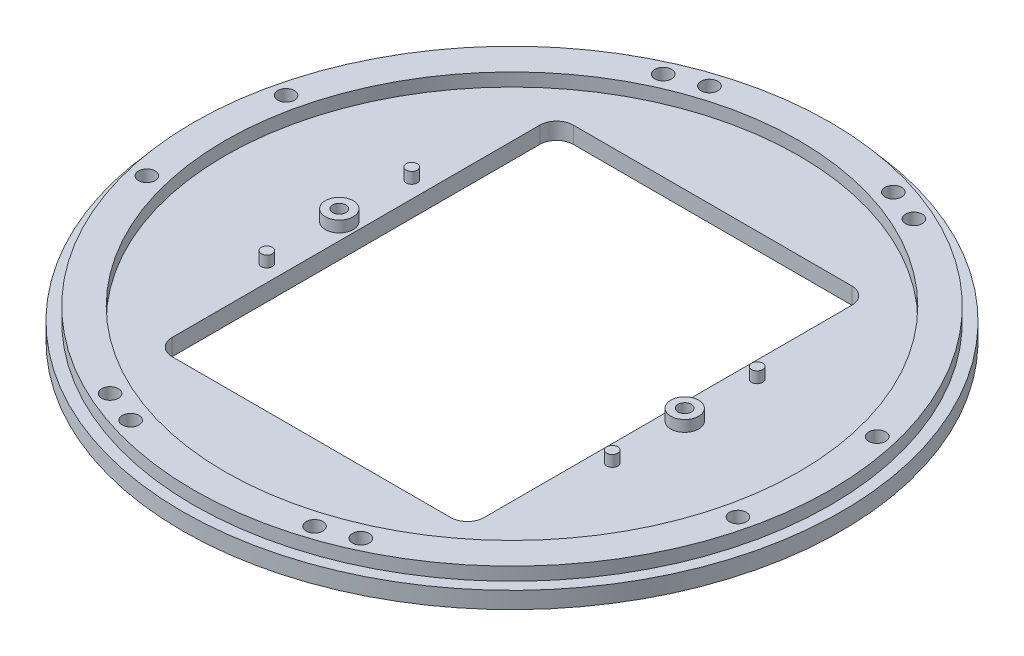
from build123d import *

# Parameters (mm, degrees)
SKETCH_3_R          = 1.5
CUT_EXTRUDE_1_DEPTH = 84.821641
SKETCH_2_R          = 51.5
SKETCH_2_W          = 56
SKETCH_2_H          = 72
EXTRUDE_1_DEPTH     = 3
SKETCH_4_R          = 1
SKETCH_4_R_2        = 2.5
EXTRUDE_2_DEPTH     = 2
SKETCH_5_R          = 1.2
CUT_EXTRUDE_2_DEPTH = 84.800029833
FILLET_2_R          = 3
SKETCH_11_R         = 1.5
CUT_EXTRUDE_6_DEPTH = 84.821641


with BuildPart() as part:
    # 草图1 → 旋转1 (revolve)
    with BuildSketch(Plane.XY, mode=Mode.PRIVATE) as revolve_1_sk:
        Polygon((51.5, 2.35), (51.5, -3), (59.15, -3), (59.15, 0), (57.15, 0), (57.15, 2.35), align=None)
    revolve(revolve_1_sk.sketch.rotate(Axis((0, 0, 0), (0, 1, 0)), 90), axis=Axis((0, 0, 0), (0, 1, 0)))

    # 草图3 → 切除-拉伸1 (cut, through all)
    with BuildSketch(Plane(origin=(0, 2.35, 0), x_dir=(1, 0, 0), z_dir=(0, 1, 0))):
        with Locations(Location((-16.5, -51.942275653, 0), (0, 0, 270))):
            Circle(SKETCH_3_R)
        with Locations(Location((-22.5, -49.638694584, 0), (0, 0, 270))):
            Circle(SKETCH_3_R)
        with Locations(Location((-22.5, 49.638694584, 0), (0, 0, 90))):
            Circle(SKETCH_3_R)
        with Locations(Location((-16.5, 51.942275653, 0), (0, 0, 90))):
            Circle(SKETCH_3_R)
        with Locations(Location((16.5, 51.942275653, 0), (0, 0, 270))):
            Circle(SKETCH_3_R)
        with Locations(Location((22.5, 49.638694584, 0), (0, 0, 270))):
            Circle(SKETCH_3_R)
        with Locations(Location((22.5, -49.638694584, 0), (0, 0, 90))):
            Circle(SKETCH_3_R)
        with Locations(Location((16.5, -51.942275653, 0), (0, 0, 90))):
            Circle(SKETCH_3_R)
    extrude(amount=-CUT_EXTRUDE_1_DEPTH, mode=Mode.SUBTRACT)

    # 草图2 → 凸台-拉伸1 (add)
    with BuildSketch(Plane.XZ.offset(3)):
        with Locations(Location((0, 0, 0), (0, 0, 270))):
            Circle(SKETCH_2_R)
        Rectangle(SKETCH_2_W, SKETCH_2_H, mode=Mode.SUBTRACT)
    extrude(amount=-EXTRUDE_1_DEPTH)

    # 草图4 → 凸台-拉伸2 (add)
    with BuildSketch(Plane(origin=(0, 0, 0), x_dir=(1, 0, 0), z_dir=(0, 1, 0))):
        with Locations(Location((31, -13, 0), (0, 0, 90))):
            Circle(SKETCH_4_R)
        with Locations(Location((-31, -13, 0), (0, 0, 90))):
            Circle(SKETCH_4_R)
        with Locations(Location((-31, 13, 0), (0, 0, 90))):
            Circle(SKETCH_4_R)
        with Locations(Location((31, 13, 0), (0, 0, 90))):
            Circle(SKETCH_4_R)
        with Locations(Location((31, 0, 0), (0, 0, 90))):
            Circle(SKETCH_4_R_2)
        with Locations(Location((-31, 0, 0), (0, 0, 90))):
            Circle(SKETCH_4_R_2)
    extrude(amount=EXTRUDE_2_DEPTH)

    # 草图5 → 切除-拉伸2 (cut, through all)
    with BuildSketch(Plane(origin=(0, 2, 0), x_dir=(1, 0, 0), z_dir=(0, 1, 0))):
        with Locations(Location((31, 0, 0), (0, 0, 270))):
            Circle(SKETCH_5_R)
        with Locations(Location((-31, 0, 0), (0, 0, 270))):
            Circle(SKETCH_5_R)
    extrude(amount=-CUT_EXTRUDE_2_DEPTH, mode=Mode.SUBTRACT)

    # 圆角2
    fillet_2_edges = [part.edges().sort_by_distance(p)[0] for p in [
        (-28, -1.5, -36),
        (28, -1.5, -36),
        (28, -1.5, 36),
        (-28, -1.5, 36),
    ]]
    fillet(fillet_2_edges, radius=FILLET_2_R)

    # 草图11 → 切除-拉伸6 (cut, through all)
    with BuildSketch(Plane.XZ.offset(3)):
        with Locations(Location((-53.047148839, 12.5, 0), (0, 0, 270))):
            Circle(SKETCH_11_R)
        with Locations(Location((53.047148839, 12.5, 0), (0, 0, 90))):
            Circle(SKETCH_11_R)
        with Locations(Location((53.047148839, -12.5, 0), (0, 0, 270))):
            Circle(SKETCH_11_R)
        with Locations(Location((-53.047148839, -12.5, 0), (0, 0, 90))):
            Circle(SKETCH_11_R)
    extrude(amount=-CUT_EXTRUDE_6_DEPTH, mode=Mode.SUBTRACT)


solid = part.part
